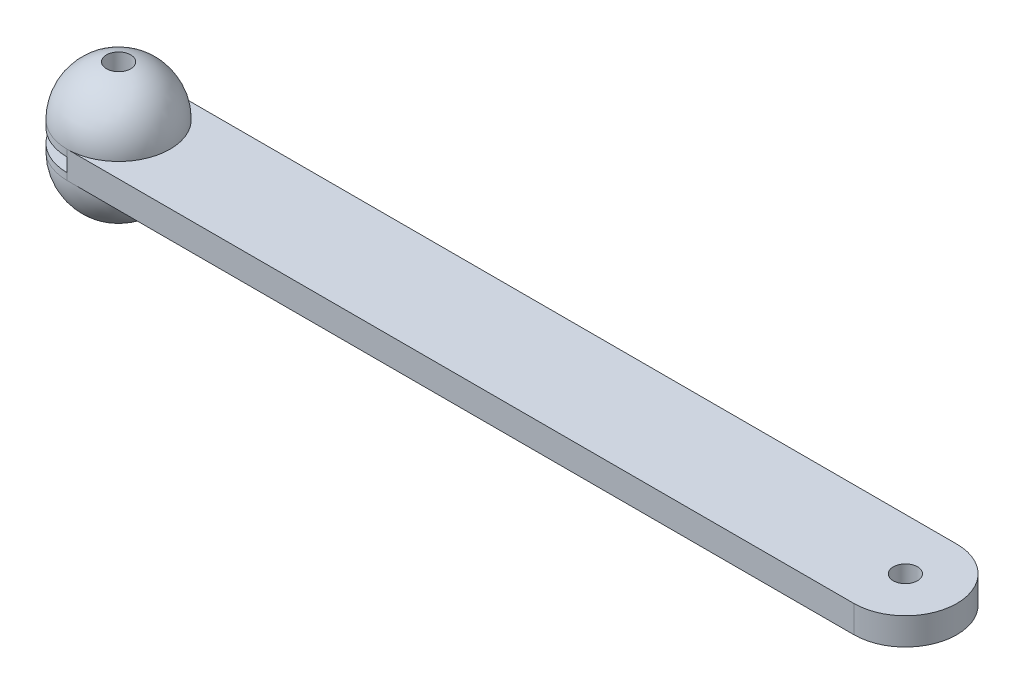
from build123d import *

# Parameters (mm, degrees)
BOSS_EXTRU_1_DEPTH           = 8
ESQUISSE2_R                  = 7.15
ENL_V_MAT_EXTRU_1_DEPTH      = 265.732643435
R_VOLUTION1_ANGLE            = 180
ESQUISSE4_R                  = 30.35
ENL_V_MAT_EXTRU_2_DEPTH      = 4
ENL_V_MAT_EXTRU_3_DEPTH      = 268.017031292
ENL_V_MAT_EXTRU_3_DEPTH_BACK = 268.017031292
ESQUISSE5_R                  = 7.15


with BuildPart() as part:
    # Esquisse1 → Boss.-Extru.1 (new, symmetric)
    with BuildSketch(Plane(origin=(0, 0, 0), x_dir=(1, 0, 0), z_dir=(0, 1, 0))):
        with BuildLine():
            Line((-232.15, 30.35), (232.15, 30.35))
            ThreePointArc((232.15, 30.35), (262.5, 0), (232.15, -30.35))
            Line((232.15, -30.35), (-232.15, -30.35))
            ThreePointArc((-232.15, -30.35), (-262.5, 0), (-232.15, 30.35))
        make_face()
    extrude(amount=BOSS_EXTRU_1_DEPTH, both=True)

    # Esquisse2 → Enlèv. mat.-Extru.1 (cut, through all)
    with BuildSketch(Plane(origin=(0, 8, 0), x_dir=(1, 0, 0), z_dir=(0, 1, 0))):
        with Locations(Location((232.15, 0, 0), (0, 0, 270))):
            Circle(ESQUISSE2_R)
    extrude(amount=-ENL_V_MAT_EXTRU_1_DEPTH, mode=Mode.SUBTRACT)

    # Esquisse3 → Révolution1 (revolve)
    with BuildSketch(Plane(origin=(0, 8, 0), x_dir=(1, 0, 0), z_dir=(0, 1, 0))):
        with BuildLine():
            Line((-232.15, 30.35), (-232.15, -30.35))
            ThreePointArc((-232.15, -30.35), (-262.5, 0), (-232.15, 30.35))
        make_face()
    r_volution1 = revolve(axis=Axis((-232.15, 8, -30.35), (0, 0, -1)), revolution_arc=R_VOLUTION1_ANGLE)

    # Symétrie1: Révolution1 across plane
    add(r_volution1.mirror(Plane.ZX))

    # Esquisse4 → Enlèv. mat.-Extru.2 (cut, symmetric)
    with BuildSketch(Plane(origin=(0, 0, 0), x_dir=(1, 0, 0), z_dir=(0, 1, 0))):
        with Locations((-232.15, 0)):
            Circle(ESQUISSE4_R)
    extrude(amount=ENL_V_MAT_EXTRU_2_DEPTH, both=True, mode=Mode.SUBTRACT)

    # Esquisse5 → Enlèv. mat.-Extru.3 (cut, two sides: drawn at the far end of the back side and taken through both)
    with BuildSketch(Plane(origin=(0, 0, 0), x_dir=(1, 0, 0), z_dir=(0, 1, 0)).offset(-ENL_V_MAT_EXTRU_3_DEPTH_BACK)):
        with Locations(Location((-232.15, 0, 0), (0, 0, 270))):
            Circle(ESQUISSE5_R)
    extrude(amount=ENL_V_MAT_EXTRU_3_DEPTH + ENL_V_MAT_EXTRU_3_DEPTH_BACK, mode=Mode.SUBTRACT)


solid = part.part
